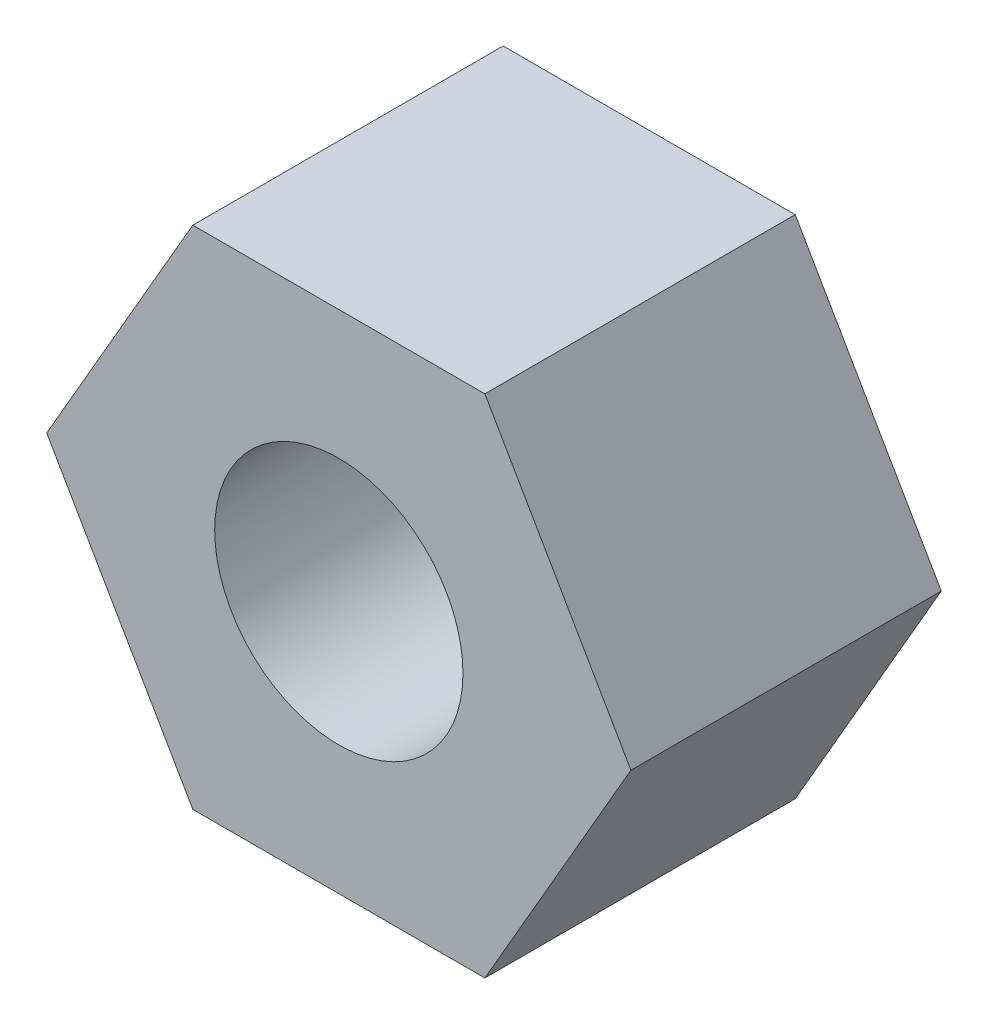
from build123d import *

# Parameters (mm, degrees)
BOSS_EXTRUDE1_DEPTH                                 = 2.125
CSK_FOR_M3_COUNTERSUNK_FLAT_HEAD_SCREW1_D           = 3.4
CSK_FOR_M3_COUNTERSUNK_FLAT_HEAD_SCREW1_DEPTH       = 5
CSK_FOR_M3_COUNTERSUNK_FLAT_HEAD_SCREW1_CSINK_D     = 6.3
CSK_FOR_M3_COUNTERSUNK_FLAT_HEAD_SCREW1_CSINK_ANGLE = 90
CSK_FOR_M3_COUNTERSUNK_FLAT_HEAD_SCREW1_TIP         = 1.021463052


with BuildPart() as part:
    # Sketch1 → Boss-Extrude1 (new, symmetric)
    with BuildSketch(Plane.XY):
        Polygon((2, -3.464101615), (4, 0), (2, 3.464101615), (-2, 3.464101615), (-4, 0), (-2, -3.464101615), align=None)
    extrude(amount=BOSS_EXTRUDE1_DEPTH, both=True)

    # CSK for M3 Countersunk Flat Head Screw1
    with Locations(Plane(origin=(0, 0, -2.125), x_dir=(-1, 0, 0), z_dir=(0, 0, -1))):
        with Locations((0, 0)):
            CounterSinkHole(CSK_FOR_M3_COUNTERSUNK_FLAT_HEAD_SCREW1_D / 2, CSK_FOR_M3_COUNTERSUNK_FLAT_HEAD_SCREW1_CSINK_D / 2, depth=CSK_FOR_M3_COUNTERSUNK_FLAT_HEAD_SCREW1_DEPTH, counter_sink_angle=CSK_FOR_M3_COUNTERSUNK_FLAT_HEAD_SCREW1_CSINK_ANGLE)
            with Locations((0, 0, -(CSK_FOR_M3_COUNTERSUNK_FLAT_HEAD_SCREW1_DEPTH + CSK_FOR_M3_COUNTERSUNK_FLAT_HEAD_SCREW1_TIP / 2))):  # 118° drill point
                Cone(0, CSK_FOR_M3_COUNTERSUNK_FLAT_HEAD_SCREW1_D / 2, CSK_FOR_M3_COUNTERSUNK_FLAT_HEAD_SCREW1_TIP, mode=Mode.SUBTRACT)


solid = part.part
